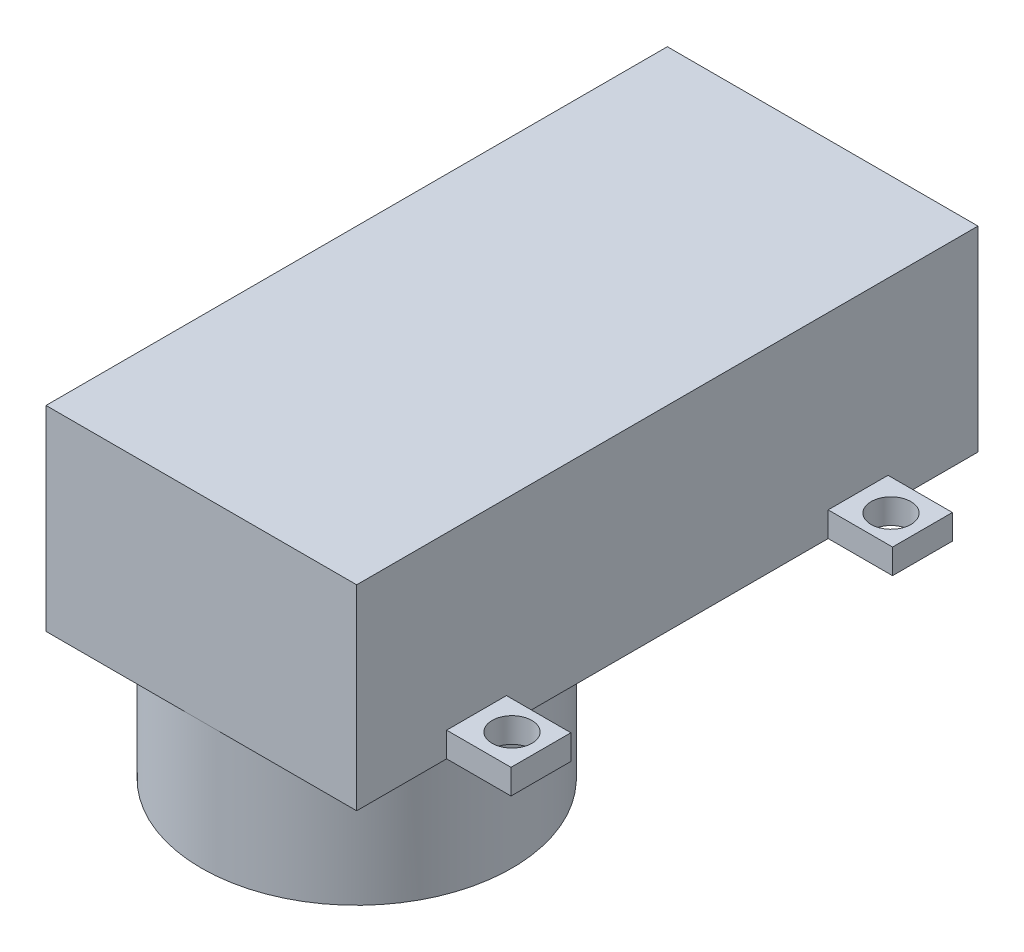
from build123d import *

# Parameters (mm, degrees)
SKETCH_1_R      = 1.6
EXTRUDE_1_DEPTH = 2
SKETCH_2_W      = 25
SKETCH_2_H      = 50
EXTRUDE_2_DEPTH = 13.75
SKETCH_3_R      = 12.5
EXTRUDE_3_DEPTH = 10.25


with BuildPart() as part:
    # 草图1 → 凸台-拉伸1 (new body)
    with BuildSketch(Plane(origin=(0, 0, 0), x_dir=(1, 0, 0), z_dir=(0, 1, 0))):
        Polygon((-12.5, 25), (12.5, 25), (12.5, 17.760130657), (17.680206778, 17.760130657), (17.680206778, 12.943452398), (12.5, 12.943452398), (12.5, -12.943452398), (17.680206778, -12.943452398), (17.680206778, -17.760130657), (12.5, -17.760130657), (12.5, -25), (-12.5, -25), (-12.5, -17.760130657), (-17.680206778, -17.760130657), (-17.680206778, -12.943452398), (-12.5, -12.943452398), (-12.5, 12.943452398), (-17.680206778, 12.943452398), (-17.680206778, 17.760130657), (-12.5, 17.760130657), align=None)
        with Locations(Location((15.25, 15.25, 0), (0, 0, 270))):
            Circle(SKETCH_1_R, mode=Mode.SUBTRACT)
        with Locations(Location((-15.25, 15.25, 0), (0, 0, 90))):
            Circle(SKETCH_1_R, mode=Mode.SUBTRACT)
        with Locations(Location((15.25, -15.25, 0), (0, 0, 90))):
            Circle(SKETCH_1_R, mode=Mode.SUBTRACT)
        with Locations(Location((-15.25, -15.25, 0), (0, 0, 270))):
            Circle(SKETCH_1_R, mode=Mode.SUBTRACT)
    extrude(amount=EXTRUDE_1_DEPTH)

    # 草图2 → 凸台-拉伸2 (add)
    with BuildSketch(Plane(origin=(0, 2, 0), x_dir=(1, 0, 0), z_dir=(0, 1, 0))):
        Rectangle(SKETCH_2_W, SKETCH_2_H)
    extrude(amount=EXTRUDE_2_DEPTH)

    # 草图3 → 凸台-拉伸3 (add)
    with BuildSketch(Plane.XZ):
        with Locations(Location((0, 12.5, 0), (0, 0, 90))):
            Circle(SKETCH_3_R)
    extrude(amount=EXTRUDE_3_DEPTH)


solid = part.part
